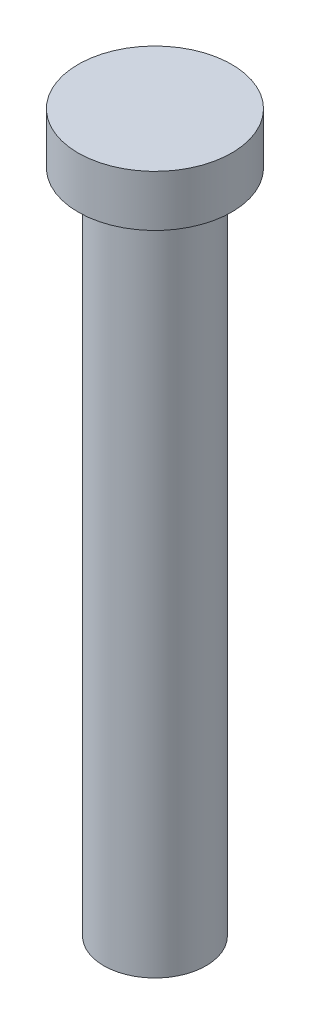
from build123d import *


with BuildPart() as part:
    # 스케치1 → 회전1 (revolve)
    with BuildSketch(Plane(origin=(0, 0, 0), x_dir=(0, 0, -1), z_dir=(1, 0, 0)), mode=Mode.PRIVATE) as revolve_1_sk:
        Polygon((0, 16.246180973), (3, 16.246180973), (3, 14.246180973), (2, 14.246180973), (2, -11.753819027), (0, -11.753819027), align=None)
    revolve(revolve_1_sk.sketch.rotate(Axis((0, 20.990482646, 0), (0, -1, 0)), 180), axis=Axis((0, 20.990482646, 0), (0, -1, 0)))


solid = part.part
